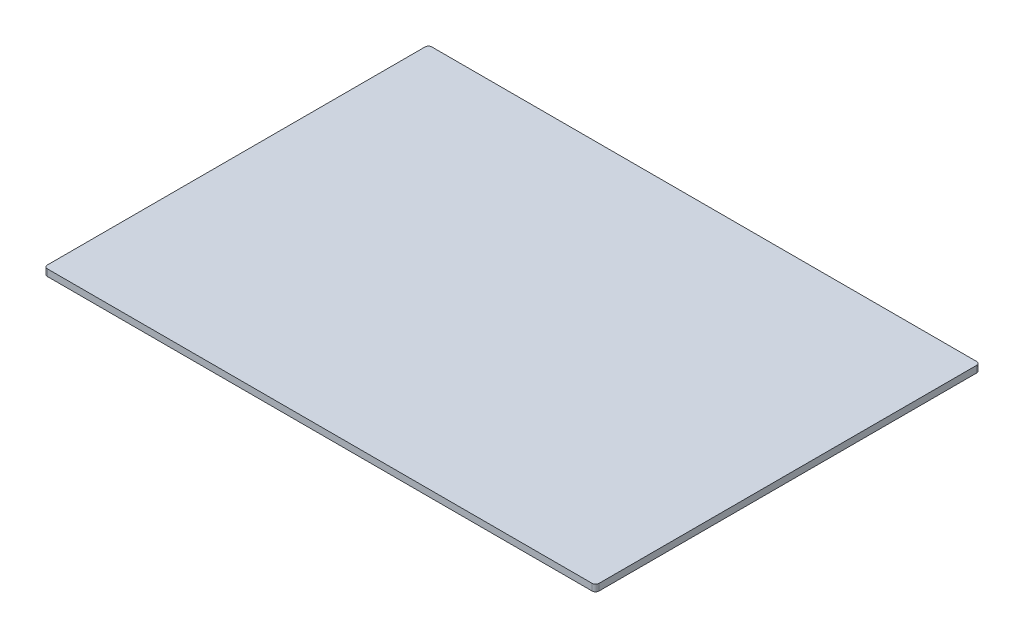
from build123d import *

# Parameters (mm, degrees)
SKETCH1_W           = 165
SKETCH1_H           = 115
BOSS_EXTRUDE1_DEPTH = 2
FILLET1_R           = 1


with BuildPart() as part:
    # Sketch1 → Boss-Extrude1 (new body)
    with BuildSketch(Plane(origin=(0, 0, 0), x_dir=(1, 0, 0), z_dir=(0, 1, 0))):
        Rectangle(SKETCH1_W, SKETCH1_H)
    extrude(amount=BOSS_EXTRUDE1_DEPTH)

    # Fillet1
    fillet1_edges = [part.edges().sort_by_distance(p)[0] for p in [
        (82.5, 1, 57.5),
        (-82.5, 1, 57.5),
        (-82.5, 1, -57.5),
        (82.5, 1, -57.5),
    ]]
    fillet(fillet1_edges, radius=FILLET1_R)


solid = part.part
